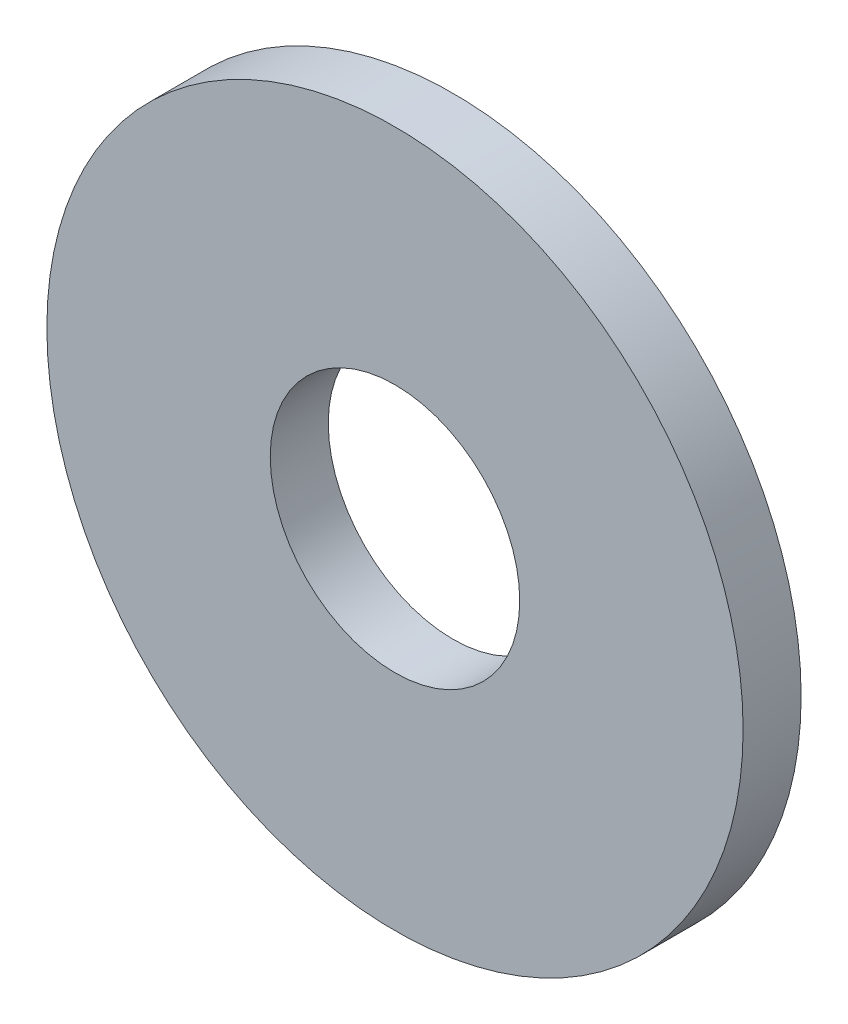
from build123d import *

# Parameters (mm, degrees)
SKETCH2_R           = 6
SKETCH2_R_2         = 2.15
BOSS_EXTRUDE1_DEPTH = 0.5


with BuildPart() as part:
    # Sketch2 → Boss-Extrude1 (new, symmetric)
    with BuildSketch(Plane.XY):
        Circle(SKETCH2_R)
        Circle(SKETCH2_R_2, mode=Mode.SUBTRACT)
    extrude(amount=BOSS_EXTRUDE1_DEPTH, both=True)


solid = part.part
